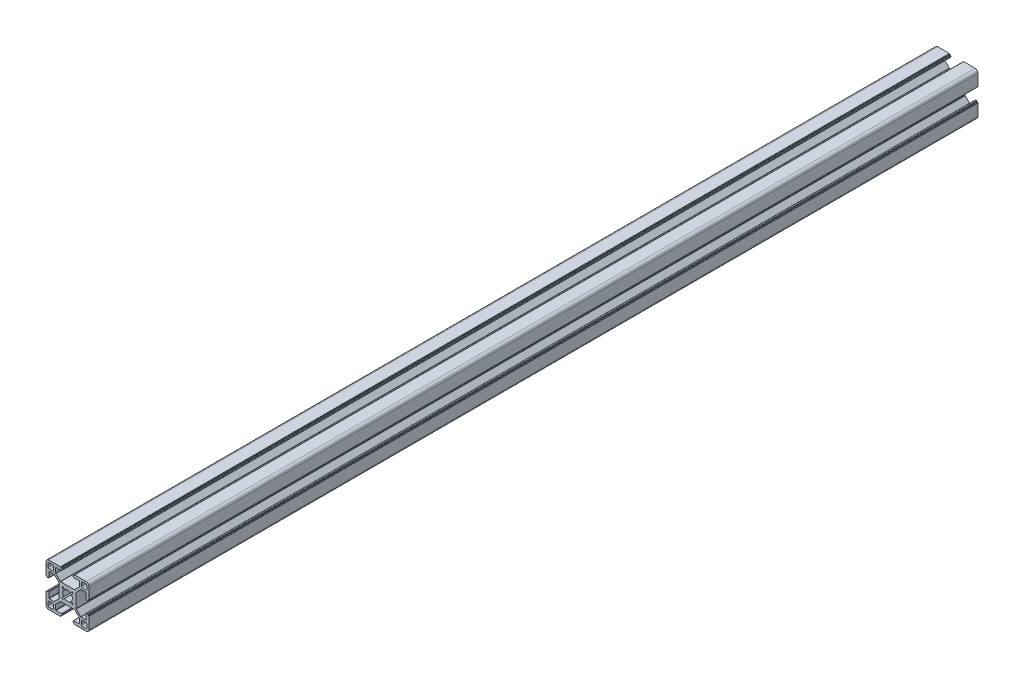
from build123d import *

# Parameters (mm, degrees)
ESTRUSIONE_ESTRUSIONE1_DEPTH = 620


with BuildPart() as part:
    # Schizzo1 → Estrusione-Estrusione1 (new body)
    with BuildSketch(Plane.XY.offset(25)):
        with BuildLine():
            Line((-4.7, -14.7), (-4.7, -14.6))
            ThreePointArc((-4.7, -14.6), (-4.612132034, -14.387867966), (-4.4, -14.3))
            Line((-4.4, -14.3), (-4.3, -14.3))
            ThreePointArc((-4.3, -14.3), (-4.087867966, -14.212132034), (-4, -14))
            Line((-4, -14), (-4, -13.3))
            ThreePointArc((-4, -13.3), (-4.087867966, -13.087867966), (-4.3, -13))
            Line((-4.3, -13), (-7.95, -13))
            ThreePointArc((-7.95, -13), (-8.162132034, -12.912132034), (-8.25, -12.7))
            Line((-8.25, -12.7), (-8.25, -9.43492424))
            ThreePointArc((-8.25, -9.43492424), (-8.22716386, -9.320119211), (-8.162132034, -9.222792206))
            Line((-8.162132034, -9.222792206), (-5.027207794, -6.087867966))
            ThreePointArc((-5.027207794, -6.087867966), (-4.929880789, -6.02283614), (-4.81507576, -6))
            Line((-4.81507576, -6), (4.81507576, -6))
            ThreePointArc((4.81507576, -6), (4.929880789, -6.02283614), (5.027207794, -6.087867966))
            Line((5.027207794, -6.087867966), (8.162132034, -9.222792206))
            ThreePointArc((8.162132034, -9.222792206), (8.22716386, -9.320119211), (8.25, -9.43492424))
            Line((8.25, -9.43492424), (8.25, -12.7))
            ThreePointArc((8.25, -12.7), (8.162132034, -12.912132034), (7.95, -13))
            Line((7.95, -13), (4.3, -13))
            ThreePointArc((4.3, -13), (4.087867966, -13.087867966), (4, -13.3))
            Line((4, -13.3), (4, -14))
            ThreePointArc((4, -14), (4.087867966, -14.212132034), (4.3, -14.3))
            Line((4.3, -14.3), (4.4, -14.3))
            ThreePointArc((4.4, -14.3), (4.612132034, -14.387867966), (4.7, -14.6))
            Line((4.7, -14.6), (4.7, -14.7))
            ThreePointArc((4.7, -14.7), (4.787867966, -14.912132034), (5, -15))
            Line((5, -15), (13, -15))
            ThreePointArc((13, -15), (14.414213562, -14.414213562), (15, -13))
            Line((15, -13), (15, -5))
            ThreePointArc((15, -5), (14.912132034, -4.787867966), (14.7, -4.7))
            Line((14.7, -4.7), (14.6, -4.7))
            ThreePointArc((14.6, -4.7), (14.387867966, -4.612132034), (14.3, -4.4))
            Line((14.3, -4.4), (14.3, -4.3))
            ThreePointArc((14.3, -4.3), (14.212132034, -4.087867966), (14, -4))
            Line((14, -4), (13.3, -4))
            ThreePointArc((13.3, -4), (13.087867966, -4.087867966), (13, -4.3))
            Line((13, -4.3), (13, -7.95))
            ThreePointArc((13, -7.95), (12.912132034, -8.162132034), (12.7, -8.25))
            Line((12.7, -8.25), (9.43492424, -8.25))
            ThreePointArc((9.43492424, -8.25), (9.320119211, -8.22716386), (9.222792206, -8.162132034))
            Line((9.222792206, -8.162132034), (6.087867966, -5.027207794))
            ThreePointArc((6.087867966, -5.027207794), (6.02283614, -4.929880789), (6, -4.81507576))
            Line((6, -4.81507576), (6, 4.81507576))
            ThreePointArc((6, 4.81507576), (6.02283614, 4.929880789), (6.087867966, 5.027207794))
            Line((6.087867966, 5.027207794), (9.222792206, 8.162132034))
            ThreePointArc((9.222792206, 8.162132034), (9.320119211, 8.22716386), (9.43492424, 8.25))
            Line((9.43492424, 8.25), (12.7, 8.25))
            ThreePointArc((12.7, 8.25), (12.912132034, 8.162132034), (13, 7.95))
            Line((13, 7.95), (13, 4.3))
            ThreePointArc((13, 4.3), (13.087867966, 4.087867966), (13.3, 4))
            Line((13.3, 4), (14, 4))
            ThreePointArc((14, 4), (14.212132034, 4.087867966), (14.3, 4.3))
            Line((14.3, 4.3), (14.3, 4.4))
            ThreePointArc((14.3, 4.4), (14.387867966, 4.612132034), (14.6, 4.7))
            Line((14.6, 4.7), (14.7, 4.7))
            ThreePointArc((14.7, 4.7), (14.912132034, 4.787867966), (15, 5))
            Line((15, 5), (15, 13))
            ThreePointArc((15, 13), (14.414213562, 14.414213562), (13, 15))
            Line((13, 15), (5, 15))
            ThreePointArc((5, 15), (4.787867966, 14.912132034), (4.7, 14.7))
            Line((4.7, 14.7), (4.7, 14.6))
            ThreePointArc((4.7, 14.6), (4.612132034, 14.387867966), (4.4, 14.3))
            Line((4.4, 14.3), (4.3, 14.3))
            ThreePointArc((4.3, 14.3), (4.087867966, 14.212132034), (4, 14))
            Line((4, 14), (4, 13.3))
            ThreePointArc((4, 13.3), (4.087867966, 13.087867966), (4.3, 13))
            Line((4.3, 13), (7.95, 13))
            ThreePointArc((7.95, 13), (8.162132034, 12.912132034), (8.25, 12.7))
            Line((8.25, 12.7), (8.25, 9.43492424))
            ThreePointArc((8.25, 9.43492424), (8.22716386, 9.320119211), (8.162132034, 9.222792206))
            Line((8.162132034, 9.222792206), (5.027207794, 6.087867966))
            ThreePointArc((5.027207794, 6.087867966), (4.929880789, 6.02283614), (4.81507576, 6))
            Line((4.81507576, 6), (-4.81507576, 6))
            ThreePointArc((-4.81507576, 6), (-4.929880789, 6.02283614), (-5.027207794, 6.087867966))
            Line((-5.027207794, 6.087867966), (-8.162132034, 9.222792206))
            ThreePointArc((-8.162132034, 9.222792206), (-8.22716386, 9.320119211), (-8.25, 9.43492424))
            Line((-8.25, 9.43492424), (-8.25, 12.7))
            ThreePointArc((-8.25, 12.7), (-8.162132034, 12.912132034), (-7.95, 13))
            Line((-7.95, 13), (-4.3, 13))
            ThreePointArc((-4.3, 13), (-4.087867966, 13.087867966), (-4, 13.3))
            Line((-4, 13.3), (-4, 14))
            ThreePointArc((-4, 14), (-4.087867966, 14.212132034), (-4.3, 14.3))
            Line((-4.3, 14.3), (-4.4, 14.3))
            ThreePointArc((-4.4, 14.3), (-4.612132034, 14.387867966), (-4.7, 14.6))
            Line((-4.7, 14.6), (-4.7, 14.7))
            ThreePointArc((-4.7, 14.7), (-4.787867966, 14.912132034), (-5, 15))
            Line((-5, 15), (-13, 15))
            ThreePointArc((-13, 15), (-14.414213562, 14.414213562), (-15, 13))
            Line((-15, 13), (-15, 5))
            ThreePointArc((-15, 5), (-14.912132034, 4.787867966), (-14.7, 4.7))
            Line((-14.7, 4.7), (-14.6, 4.7))
            ThreePointArc((-14.6, 4.7), (-14.387867966, 4.612132034), (-14.3, 4.4))
            Line((-14.3, 4.4), (-14.3, 4.3))
            ThreePointArc((-14.3, 4.3), (-14.212132034, 4.087867966), (-14, 4))
            Line((-14, 4), (-13.3, 4))
            ThreePointArc((-13.3, 4), (-13.087867966, 4.087867966), (-13, 4.3))
            Line((-13, 4.3), (-13, 7.95))
            ThreePointArc((-13, 7.95), (-12.912132034, 8.162132034), (-12.7, 8.25))
            Line((-12.7, 8.25), (-9.43492424, 8.25))
            ThreePointArc((-9.43492424, 8.25), (-9.320119211, 8.22716386), (-9.222792206, 8.162132034))
            Line((-9.222792206, 8.162132034), (-6.087867966, 5.027207794))
            ThreePointArc((-6.087867966, 5.027207794), (-6.02283614, 4.929880789), (-6, 4.81507576))
            Line((-6, 4.81507576), (-6, -4.81507576))
            ThreePointArc((-6, -4.81507576), (-6.02283614, -4.929880789), (-6.087867966, -5.027207794))
            Line((-6.087867966, -5.027207794), (-9.222792206, -8.162132034))
            ThreePointArc((-9.222792206, -8.162132034), (-9.320119211, -8.22716386), (-9.43492424, -8.25))
            Line((-9.43492424, -8.25), (-12.7, -8.25))
            ThreePointArc((-12.7, -8.25), (-12.912132034, -8.162132034), (-13, -7.95))
            Line((-13, -7.95), (-13, -4.3))
            ThreePointArc((-13, -4.3), (-13.087867966, -4.087867966), (-13.3, -4))
            Line((-13.3, -4), (-14, -4))
            ThreePointArc((-14, -4), (-14.212132034, -4.087867966), (-14.3, -4.3))
            Line((-14.3, -4.3), (-14.3, -4.4))
            ThreePointArc((-14.3, -4.4), (-14.387867966, -4.612132034), (-14.6, -4.7))
            Line((-14.6, -4.7), (-14.7, -4.7))
            ThreePointArc((-14.7, -4.7), (-14.912132034, -4.787867966), (-15, -5))
            Line((-15, -5), (-15, -13))
            ThreePointArc((-15, -13), (-14.414213562, -14.414213562), (-13, -15))
            Line((-13, -15), (-5, -15))
            ThreePointArc((-5, -15), (-4.787867966, -14.912132034), (-4.7, -14.7))
        make_face()
        with BuildLine():
            Line((-12.5625, -9.75), (-10.6875, -9.75))
            ThreePointArc((-10.6875, -9.75), (-10.024587393, -10.024587393), (-9.75, -10.6875))
            Line((-9.75, -10.6875), (-9.75, -12.5625))
            ThreePointArc((-9.75, -12.5625), (-10.024587393, -13.225412607), (-10.6875, -13.5))
            Line((-10.6875, -13.5), (-12.5625, -13.5))
            ThreePointArc((-12.5625, -13.5), (-13.225412607, -13.225412607), (-13.5, -12.5625))
            Line((-13.5, -12.5625), (-13.5, -10.6875))
            ThreePointArc((-13.5, -10.6875), (-13.225412607, -10.024587393), (-12.5625, -9.75))
        make_face(mode=Mode.SUBTRACT)
        with BuildLine():
            Line((12.5625, 9.75), (10.6875, 9.75))
            ThreePointArc((10.6875, 9.75), (10.024587393, 10.024587393), (9.75, 10.6875))
            Line((9.75, 10.6875), (9.75, 12.5625))
            ThreePointArc((9.75, 12.5625), (10.024587393, 13.225412607), (10.6875, 13.5))
            Line((10.6875, 13.5), (12.5625, 13.5))
            ThreePointArc((12.5625, 13.5), (13.225412607, 13.225412607), (13.5, 12.5625))
            Line((13.5, 12.5625), (13.5, 10.6875))
            ThreePointArc((13.5, 10.6875), (13.225412607, 10.024587393), (12.5625, 9.75))
        make_face(mode=Mode.SUBTRACT)
        with BuildLine():
            Line((2.010111251, 2.742162059), (2.867949192, 3.6))
            ThreePointArc((2.867949192, 3.6), (3.6, 3.6), (3.6, 2.867949192))
            Line((3.6, 2.867949192), (2.742162059, 2.010111251))
            ThreePointArc((2.742162059, 2.010111251), (3.4, 0), (2.742162059, -2.010111251))
            Line((2.742162059, -2.010111251), (3.6, -2.867949192))
            ThreePointArc((3.6, -2.867949192), (3.6, -3.6), (2.867949192, -3.6))
            Line((2.867949192, -3.6), (2.010111251, -2.742162059))
            ThreePointArc((2.010111251, -2.742162059), (0, -3.4), (-2.010111251, -2.742162059))
            Line((-2.010111251, -2.742162059), (-2.867949192, -3.6))
            ThreePointArc((-2.867949192, -3.6), (-3.6, -3.6), (-3.6, -2.867949192))
            Line((-3.6, -2.867949192), (-2.742162059, -2.010111251))
            ThreePointArc((-2.742162059, -2.010111251), (-3.4, 0), (-2.742162059, 2.010111251))
            Line((-2.742162059, 2.010111251), (-3.6, 2.867949192))
            ThreePointArc((-3.6, 2.867949192), (-3.6, 3.6), (-2.867949192, 3.6))
            Line((-2.867949192, 3.6), (-2.010111251, 2.742162059))
            ThreePointArc((-2.010111251, 2.742162059), (0, 3.4), (2.010111251, 2.742162059))
        make_face(mode=Mode.SUBTRACT)
        with BuildLine():
            Line((-9.75, 12.5625), (-9.75, 10.6875))
            ThreePointArc((-9.75, 10.6875), (-10.024587393, 10.024587393), (-10.6875, 9.75))
            Line((-10.6875, 9.75), (-12.5625, 9.75))
            ThreePointArc((-12.5625, 9.75), (-13.225412607, 10.024587393), (-13.5, 10.6875))
            Line((-13.5, 10.6875), (-13.5, 12.5625))
            ThreePointArc((-13.5, 12.5625), (-13.225412607, 13.225412607), (-12.5625, 13.5))
            Line((-12.5625, 13.5), (-10.6875, 13.5))
            ThreePointArc((-10.6875, 13.5), (-10.024587393, 13.225412607), (-9.75, 12.5625))
        make_face(mode=Mode.SUBTRACT)
        with BuildLine():
            Line((9.75, -12.5625), (9.75, -10.6875))
            ThreePointArc((9.75, -10.6875), (10.024587393, -10.024587393), (10.6875, -9.75))
            Line((10.6875, -9.75), (12.5625, -9.75))
            ThreePointArc((12.5625, -9.75), (13.225412607, -10.024587393), (13.5, -10.6875))
            Line((13.5, -10.6875), (13.5, -12.5625))
            ThreePointArc((13.5, -12.5625), (13.225412607, -13.225412607), (12.5625, -13.5))
            Line((12.5625, -13.5), (10.6875, -13.5))
            ThreePointArc((10.6875, -13.5), (10.024587393, -13.225412607), (9.75, -12.5625))
        make_face(mode=Mode.SUBTRACT)
    extrude(amount=-ESTRUSIONE_ESTRUSIONE1_DEPTH)


solid = part.part
